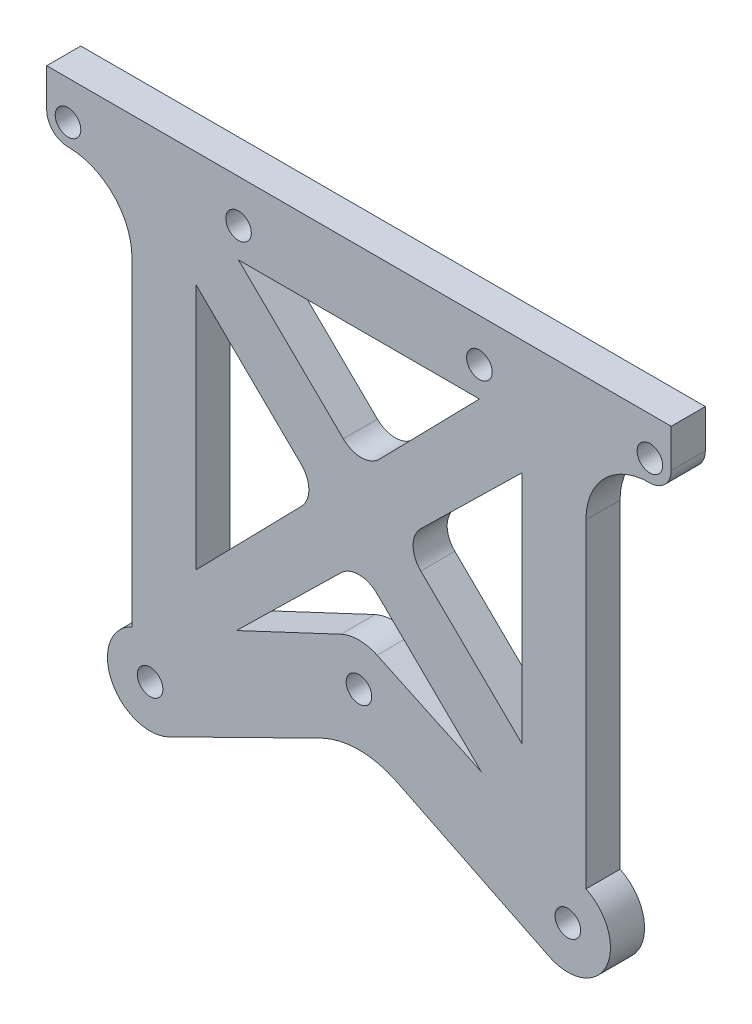
from build123d import *

# Parameters (mm, degrees)
SKETCH1_R           = 1.5
BOSS_EXTRUDE1_DEPTH = 4


with BuildPart() as part:
    # Sketch1 → Boss-Extrude1 (new body)
    # profile 1 of 2: a face of its own
    with BuildSketch(Plane.XY):
        with BuildLine():
            Line((0, 43.02618472), (-22, 43.02618472))
            Line((-22, 43.02618472), (-34.124535685, 43.02618472))
            ThreePointArc((-34.124535685, 43.02618472), (-35.892302638, 42.293951673), (-36.624535685, 40.52618472))
            ThreePointArc((-36.624535685, 40.52618472), (-35.892302638, 38.758417767), (-34.124535685, 38.02618472))
            ThreePointArc((-34.124535685, 38.02618472), (-28.821234826, 35.829485579), (-26.624535685, 30.52618472))
            Line((-26.624535685, 30.52618472), (-26.624535685, -6.97381528))
            ThreePointArc((-26.624535685, -6.97381528), (-29.02618472, -13.624535685), (-22.375464315, -16.02618472))
            Line((-22.375464315, -16.02618472), (-22.205082013, -15.942223704))
            Line((-22.205082013, -15.942223704), (-4.420251148, -7.178212035))
            ThreePointArc((-4.420251148, -7.178212035), (0, -6.148238779), (4.420251148, -7.178212035))
            Line((4.420251148, -7.178212035), (22.205082013, -15.942223704))
            Line((22.205082013, -15.942223704), (22.375464315, -16.02618472))
            ThreePointArc((22.375464315, -16.02618472), (29.02618472, -13.624535685), (26.624535685, -6.97381528))
            Line((26.624535685, -6.97381528), (26.624535685, 30.52618472))
            ThreePointArc((26.624535685, 30.52618472), (28.821234826, 35.829485579), (34.124535685, 38.02618472))
            ThreePointArc((34.124535685, 38.02618472), (35.892302638, 38.758417767), (36.624535685, 40.52618472))
            ThreePointArc((36.624535685, 40.52618472), (35.892302638, 42.293951673), (34.124535685, 43.02618472))
            Line((34.124535685, 43.02618472), (22, 43.02618472))
            Line((22, 43.02618472), (0, 43.02618472))
        make_face()
        with Locations((-24.5, -11.5)):
            Circle(SKETCH1_R, mode=Mode.SUBTRACT)
        Circle(SKETCH1_R, mode=Mode.SUBTRACT)
        with Locations((24.5, -11.5)):
            Circle(SKETCH1_R, mode=Mode.SUBTRACT)
        with BuildLine():
            Line((14.374535685, -1.22381528), (2.124535685, 4.52618472))
            ThreePointArc((2.124535685, 4.52618472), (0, 5), (-2.124535685, 4.52618472))
            Line((-2.124535685, 4.52618472), (-14.374535685, -1.22381528))
            Line((-14.374535685, -1.22381528), (-2.097868645, 10.785812849))
            ThreePointArc((-2.097868645, 10.785812849), (0, 11.641297251), (2.097868645, 10.785812849))
            Line((2.097868645, 10.785812849), (14.374535685, -1.22381528))
        make_face(mode=Mode.SUBTRACT)
        with BuildLine():
            Line((-6.73171968, 15.226590291), (-19.124535685, 2.558215038))
            Line((-19.124535685, 2.558215038), (-19.124535685, 31.546592884))
            Line((-19.124535685, 31.546592884), (-6.778366633, 19.468974534))
            ThreePointArc((-6.778366633, 19.468974534), (-5.876416612, 17.357443313), (-6.73171968, 15.226590291))
        make_face(mode=Mode.SUBTRACT)
        with Locations((-34.124535685, 40.52618472)):
            Circle(SKETCH1_R, mode=Mode.SUBTRACT)
        with BuildLine():
            Line((-1.833941699, 24.523340745), (-14.124535685, 36.546592884))
            Line((-14.124535685, 36.546592884), (14.124535685, 36.546592884))
            Line((14.124535685, 36.546592884), (2.408442543, 24.569987698))
            ThreePointArc((2.408442543, 24.569987698), (0.296911322, 23.668037677), (-1.833941699, 24.523340745))
        make_face(mode=Mode.SUBTRACT)
        with Locations((-14.124535685, 40.02618472)):
            Circle(SKETCH1_R, mode=Mode.SUBTRACT)
        with BuildLine():
            Line((19.124535685, 31.546592884), (19.124535685, 4.020746784))
            Line((19.124535685, 4.020746784), (7.24778827, 15.639154236))
            ThreePointArc((7.24778827, 15.639154236), (6.345656915, 17.783669834), (7.24778827, 19.928185432))
            Line((7.24778827, 19.928185432), (19.124535685, 31.546592884))
        make_face(mode=Mode.SUBTRACT)
        with Locations((14.124535685, 40.02618472)):
            Circle(SKETCH1_R, mode=Mode.SUBTRACT)
        with Locations((34.124535685, 40.52618472)):
            Circle(SKETCH1_R, mode=Mode.SUBTRACT)
    # profile 2 of 2: a face of its own
    with BuildSketch(Plane.XY):
        with BuildLine():
            Line((-34.124535685, 43.02618472), (-22, 43.02618472))
            Line((-22, 43.02618472), (0, 43.02618472))
            Line((0, 43.02618472), (22, 43.02618472))
            Line((22, 43.02618472), (34.124535685, 43.02618472))
            ThreePointArc((34.124535685, 43.02618472), (35.892302638, 42.293951673), (36.624535685, 40.52618472))
            Line((36.624535685, 40.52618472), (36.624535685, 45.02618472))
            Line((36.624535685, 45.02618472), (-36.624535685, 45.02618472))
            Line((-36.624535685, 45.02618472), (-36.624535685, 40.52618472))
            ThreePointArc((-36.624535685, 40.52618472), (-35.892302638, 42.293951673), (-34.124535685, 43.02618472))
        make_face()
    extrude(amount=BOSS_EXTRUDE1_DEPTH)


solid = part.part
